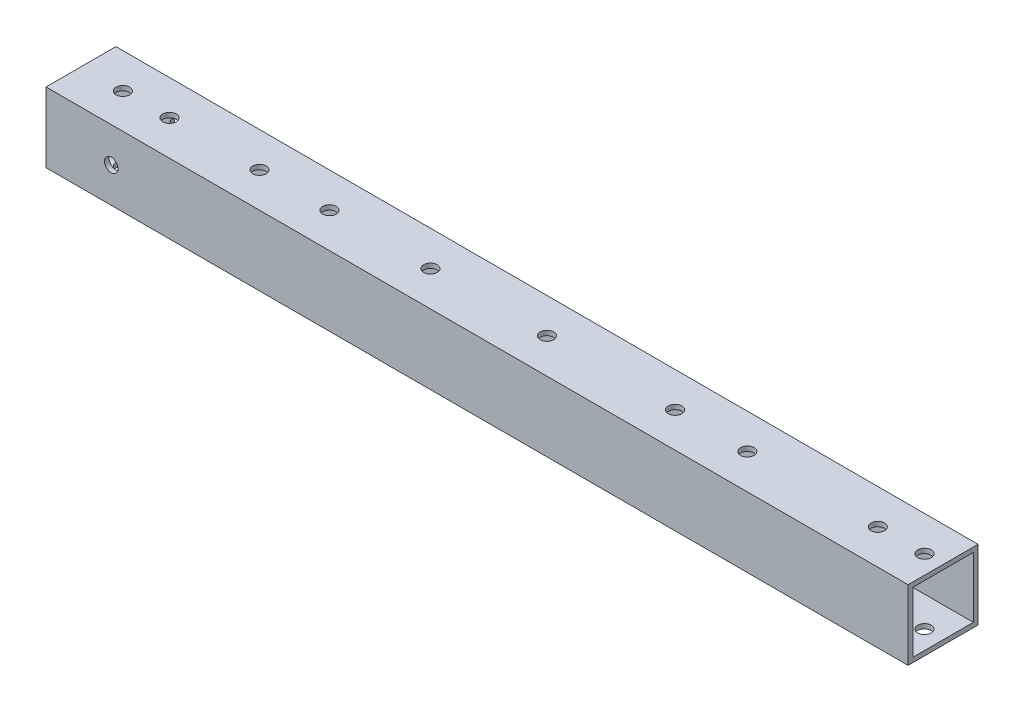
from build123d import *

# Parameters (mm, degrees)
SKETCH_1_W          = 15
SKETCH_1_H          = 15
SKETCH_1_W_2        = 13
SKETCH_1_H_2        = 13
EXTRUDE_1_DEPTH     = 185
SKETCH_2_R          = 1.45
CUT_EXTRUDE_1_DEPTH = 186.758579883
SKETCH_3_R          = 1.45
CUT_EXTRUDE_2_DEPTH = 186.758579883


with BuildPart() as part:
    # 草图1 → 凸台-拉伸1 (new body)
    with BuildSketch(Plane(origin=(0, 0, 0), x_dir=(0, 0, -1), z_dir=(1, 0, 0))):
        Rectangle(SKETCH_1_W, SKETCH_1_H)
        Rectangle(SKETCH_1_W_2, SKETCH_1_H_2, mode=Mode.SUBTRACT)
    extrude(amount=EXTRUDE_1_DEPTH)

    # 草图2 → 切除-拉伸1 (cut, through all)
    with BuildSketch(Plane.XZ.offset(7.5)):
        with Locations(Location((181, 0, 0), (0, 0, 270))):
            Circle(SKETCH_2_R)
        with Locations(Location((171, 0, 0), (0, 0, 270))):
            Circle(SKETCH_2_R)
        with Locations(Location((127.5, 0, 0), (0, 0, 270))):
            Circle(SKETCH_2_R)
        with Locations(Location((100, 0, 0), (0, 0, 270))):
            Circle(SKETCH_2_R)
        with Locations(Location((75, 0, 0), (0, 0, 270))):
            Circle(SKETCH_2_R)
        with Locations(Location((19, 0, 0), (0, 0, 270))):
            Circle(SKETCH_2_R)
        with Locations(Location((9, 0, 0), (0, 0, 270))):
            Circle(SKETCH_2_R)
        with Locations(Location((143, 0, 0), (0, 0, 270))):
            Circle(SKETCH_2_R)
        with Locations(Location((38.322949017, 0, 0), (0, 0, 270))):
            Circle(SKETCH_2_R)
        with Locations(Location((53.322949017, 0, 0), (0, 0, 270))):
            Circle(SKETCH_2_R)
    extrude(amount=-CUT_EXTRUDE_1_DEPTH, mode=Mode.SUBTRACT)

    # 草图3 → 切除-拉伸2 (cut, through all)
    with BuildSketch(Plane.XY.offset(7.5)):
        with Locations((14, 0)):
            Circle(SKETCH_3_R)
    extrude(amount=-CUT_EXTRUDE_2_DEPTH, mode=Mode.SUBTRACT)


solid = part.part
